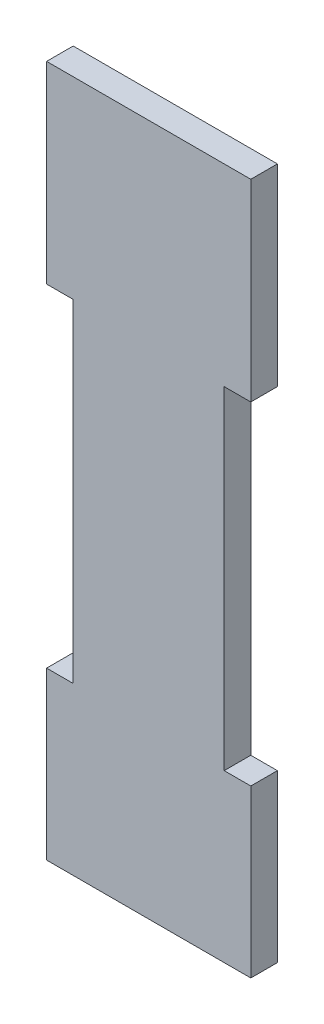
from build123d import *

# Parameters (mm, degrees)
EXTRUDE_1_DEPTH = 4


with BuildPart() as part:
    # Эскиз1 → Бобышка-Вытянуть1 (new body)
    with BuildSketch(Plane.XY):
        Polygon((0, 0), (-10, 0), (-13, 0), (-13, 25), (-9, 25), (-9, 75), (-13, 75), (-13, 100), (-13, 104), (17.7, 104), (17.7, 100), (17.7, 75), (13.7, 75), (13.7, 25), (17.7, 25), (17.7, 0), align=None)
    extrude(amount=EXTRUDE_1_DEPTH)


solid = part.part
